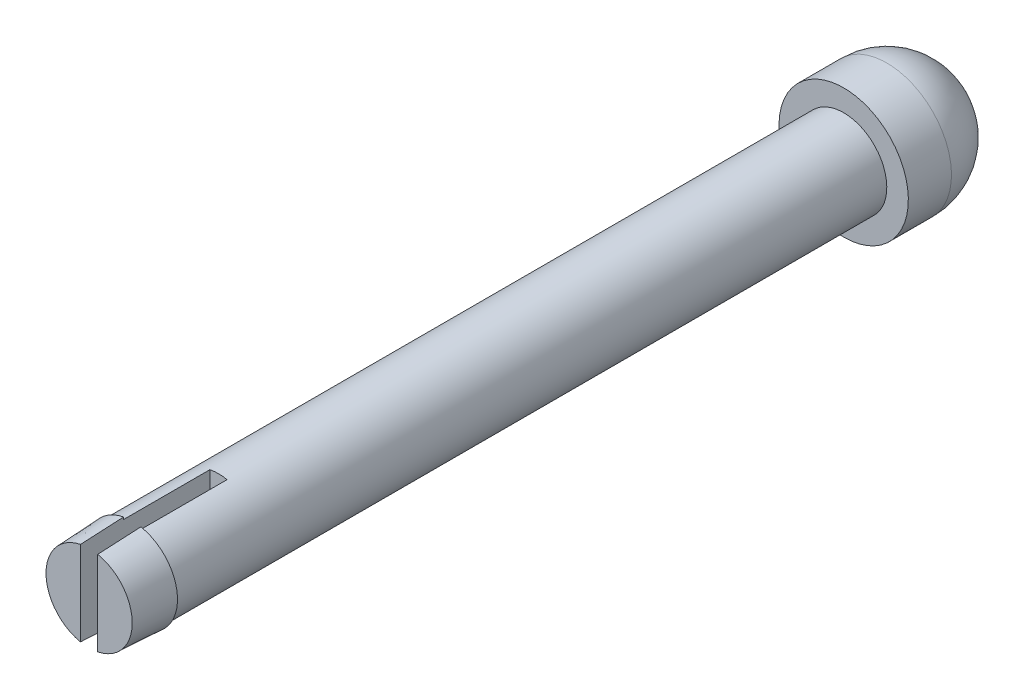
from build123d import *

# Parameters (mm, degrees)
SKETCH_1_R          = 2
EXTRUDE_1_DEPTH     = 36
CUT_EXTRUDE_1_DEPTH = 6


with BuildPart() as part:
    # 草图1 → 凸台-拉伸1 (new body)
    with BuildSketch(Plane.XY):
        Circle(SKETCH_1_R)
    extrude(amount=-EXTRUDE_1_DEPTH)

    # 草图2 → 旋转1 (revolve)
    with BuildSketch(Plane(origin=(0, 0, 0), x_dir=(0, 0, -1), z_dir=(1, 0, 0))):
        with BuildLine():
            Line((35, 0), (40, 0))
            ThreePointArc((40, 0), (39.121320344, -2.121320344), (37, -3))
            Line((37, -3), (35, -3))
            Line((35, -3), (35, 0))
        make_face()
    revolve(axis=Axis((0, 0, -35), (0, 0, -1)))

    # 草图3 → 旋转2 (revolve)
    with BuildSketch(Plane(origin=(0, 0, 0), x_dir=(0, 0, -1), z_dir=(1, 0, 0))):
        Polygon((0, 2), (0, 0), (2, 0), (2, 2.1), align=None)
    revolve(axis=Axis((0, 0, -2), (0, 0, 1)))

    # 草图4 → 切除-拉伸1 (cut)
    with BuildSketch(Plane.XY):
        with BuildLine():
            Line((-0.4, -2.061552813), (-0.4, 2.061552813))
            ThreePointArc((-0.4, 2.061552813), (0, 2.1), (0.4, 2.061552813))
            Line((0.4, 2.061552813), (0.4, -2.061552813))
            ThreePointArc((0.4, -2.061552813), (0, -2.1), (-0.4, -2.061552813))
        make_face()
    extrude(amount=-CUT_EXTRUDE_1_DEPTH, mode=Mode.SUBTRACT)


solid = part.part
